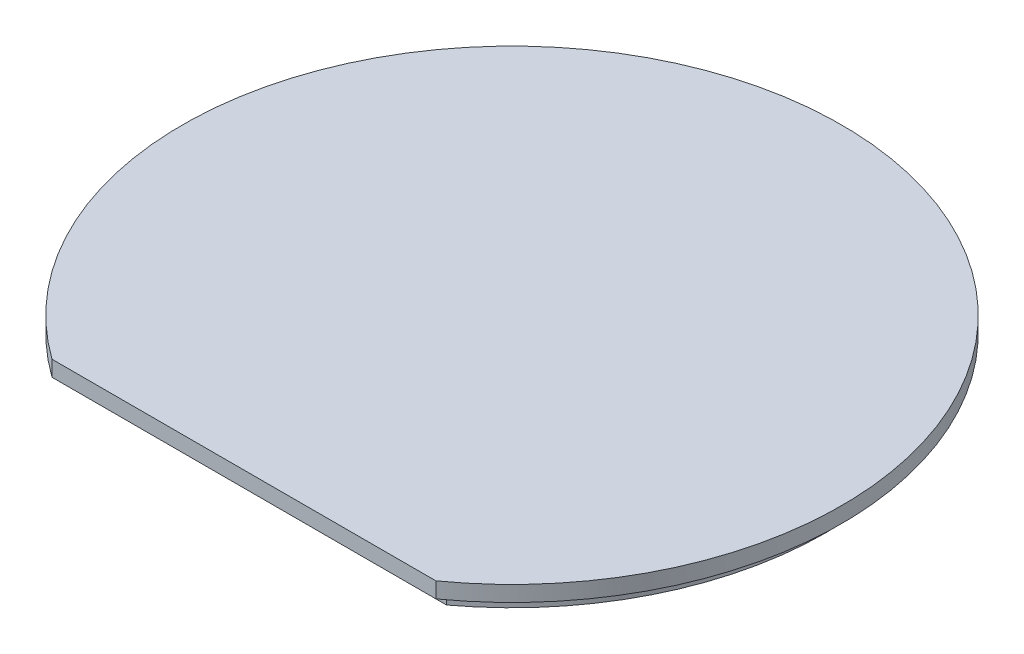
from build123d import *

# Parameters (mm, degrees)
BOSS_EXTRUDE1_DEPTH = 2.38125
SKETCH3_OUTSIDE_W   = 129.43
SKETCH3_OUTSIDE_H   = 120.054
CUT_EXTRUDE1_DEPTH  = 2.38125


with BuildPart() as part:
    # Sketch2 → Boss-Extrude1 (new, symmetric)
    with BuildSketch(Plane(origin=(0, 0, 0), x_dir=(1, 0, 0), z_dir=(0, 1, 0))):
        with BuildLine():
            Line((-29.2030912, -40.788560766), (29.2030912, -40.788560766))
            ThreePointArc((29.2030912, -40.788560766), (0, 50.165), (-29.2030912, -40.788560766))
        make_face()
    extrude(amount=BOSS_EXTRUDE1_DEPTH, both=True)

    # Sketch3 outside → Cut-Extrude1 (cut)
    with BuildSketch(Plane.XZ.offset(2.38125)):
        with Locations((0, -4.688)):
            Rectangle(SKETCH3_OUTSIDE_W, SKETCH3_OUTSIDE_H)
        with BuildLine():
            Line((-28.428247287, 38.407310766), (28.428247287, 38.407310766))
            ThreePointArc((28.428247287, 38.407310766), (0, -47.78375), (-28.428247287, 38.407310766))
        make_face(mode=Mode.SUBTRACT)
    extrude(amount=-CUT_EXTRUDE1_DEPTH, mode=Mode.SUBTRACT)


solid = part.part
